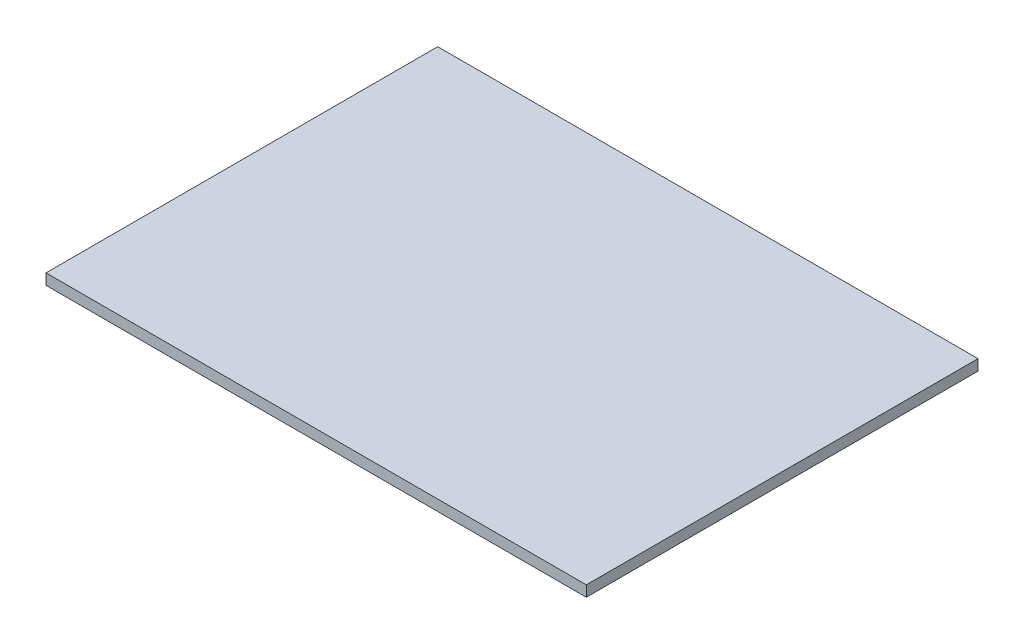
from build123d import *

# Parameters (mm, degrees)
SKETCH1_W           = 635
SKETCH1_H           = 460.375
BOSS_EXTRUDE1_DEPTH = 12.7


with BuildPart() as part:
    # Sketch1 → Boss-Extrude1 (new body)
    with BuildSketch(Plane(origin=(0, 0, 0), x_dir=(1, 0, 0), z_dir=(0, 1, 0))):
        Rectangle(SKETCH1_W, SKETCH1_H)
    extrude(amount=BOSS_EXTRUDE1_DEPTH)


solid = part.part
